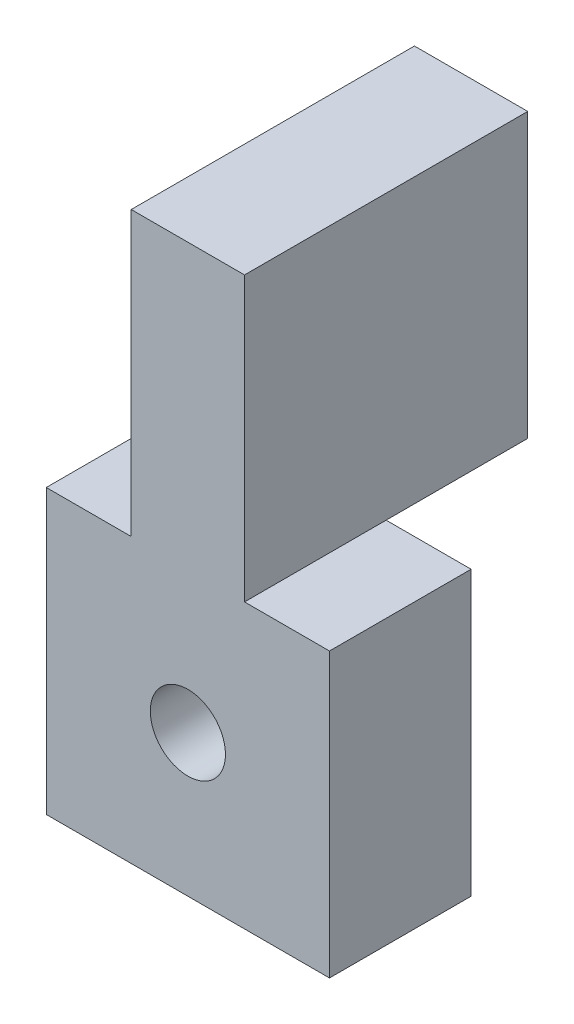
from build123d import *

# Parameters (mm, degrees)
BOSS_EXTRUDE1_DEPTH        = 10
F_4_0_209_DIAMETER_HOLE1_D = 5.3086
SKETCH1_3_W                = 8
SKETCH1_3_H                = 20
BOSS_EXTRUDE2_DEPTH        = 10


with BuildPart() as part:
    # Sketch1 → Boss-Extrude1 (new body)
    with BuildSketch(Plane.XY):
        Polygon((-4, 10), (-10, 10), (-10, -10), (10, -10), (10, 10), (4, 10), (4, 30), (-4, 30), align=None)
    extrude(amount=BOSS_EXTRUDE1_DEPTH)

    # #4 (0.209) Diameter Hole1 (through all)
    with Locations(Plane.XY.offset(10)):
        with Locations((0, 0)):
            Hole(F_4_0_209_DIAMETER_HOLE1_D / 2)

    # Sketch1<3> → Boss-Extrude2 (add)
    with BuildSketch(Plane.XY):
        with Locations((0, 20)):
            Rectangle(SKETCH1_3_W, SKETCH1_3_H)
    extrude(amount=-BOSS_EXTRUDE2_DEPTH)


solid = part.part
